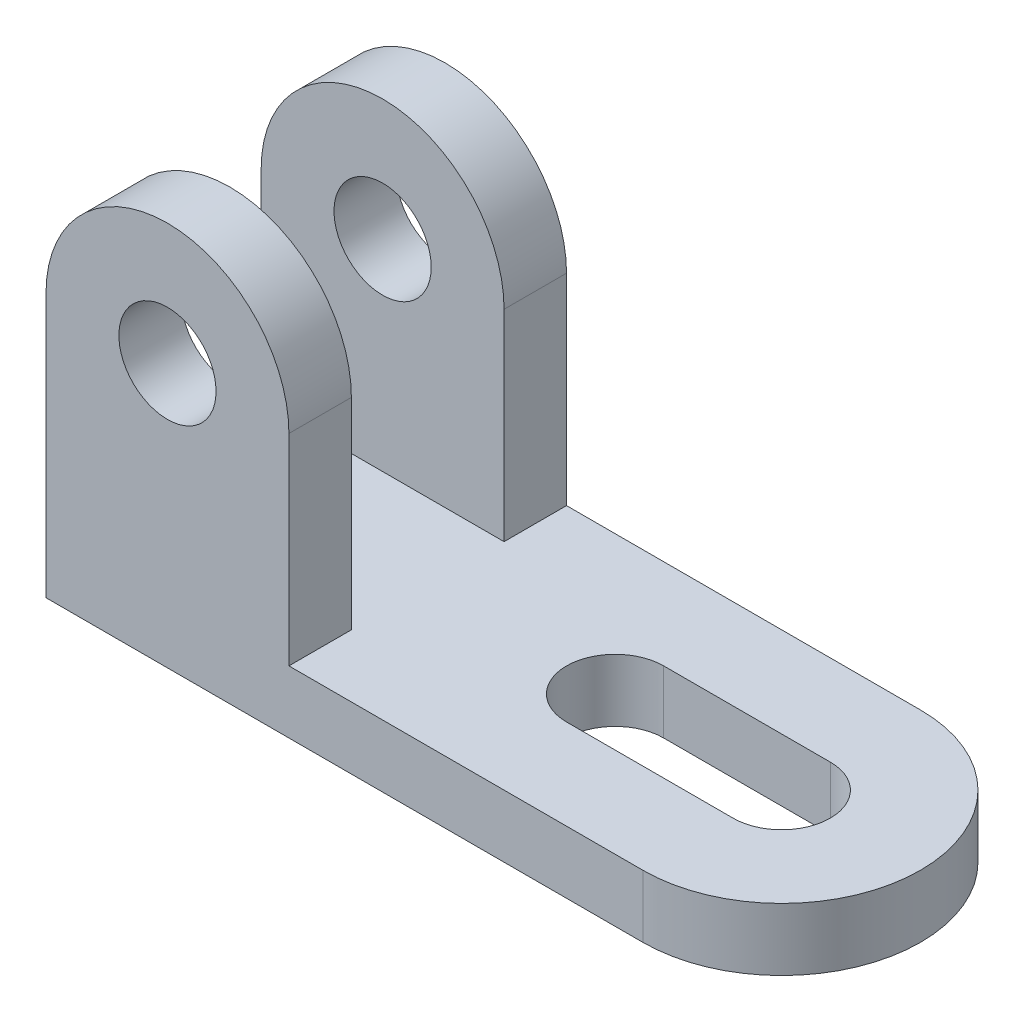
from build123d import *

# Parameters (mm, degrees)
BOSS_EXTRUDE1_DEPTH = 9
SKETCH4_R           = 7
BOSS_EXTRUDE2_DEPTH = 9


with BuildPart() as part:
    # Sketch2 → Boss-Extrude1 (new body)
    with BuildSketch(Plane(origin=(0, 0, 0), x_dir=(1, 0, 0), z_dir=(0, 1, 0))):
        with BuildLine():
            Line((0, -20), (-86, -20))
            Line((-86, -20), (-86, 20))
            Line((-86, 20), (0, 20))
            ThreePointArc((0, 20), (20, 0), (0, -20))
        make_face()
        with BuildLine():
            Line((-24, 7), (0, 7))
            ThreePointArc((0, 7), (7, 0), (0, -7))
            Line((0, -7), (-24, -7))
            ThreePointArc((-24, -7), (-31, 0), (-24, 7))
        make_face(mode=Mode.SUBTRACT)
    extrude(amount=BOSS_EXTRUDE1_DEPTH)

    # Sketch4 → Boss-Extrude2 (add)
    with BuildSketch(Plane.XY.offset(20)):
        with BuildLine():
            Line((-86, 0), (-86, 38))
            ThreePointArc((-86, 38), (-68.5, 55.5), (-51, 38))
            Line((-51, 38), (-51, 0))
            Line((-51, 0), (-86, 0))
        make_face()
        with Locations((-68.5, 38)):
            Circle(SKETCH4_R, mode=Mode.SUBTRACT)
    boss_extrude2 = extrude(amount=-BOSS_EXTRUDE2_DEPTH)

    # Mirror1: Boss-Extrude2 across plane
    add(boss_extrude2.mirror(Plane.XY))


solid = part.part
